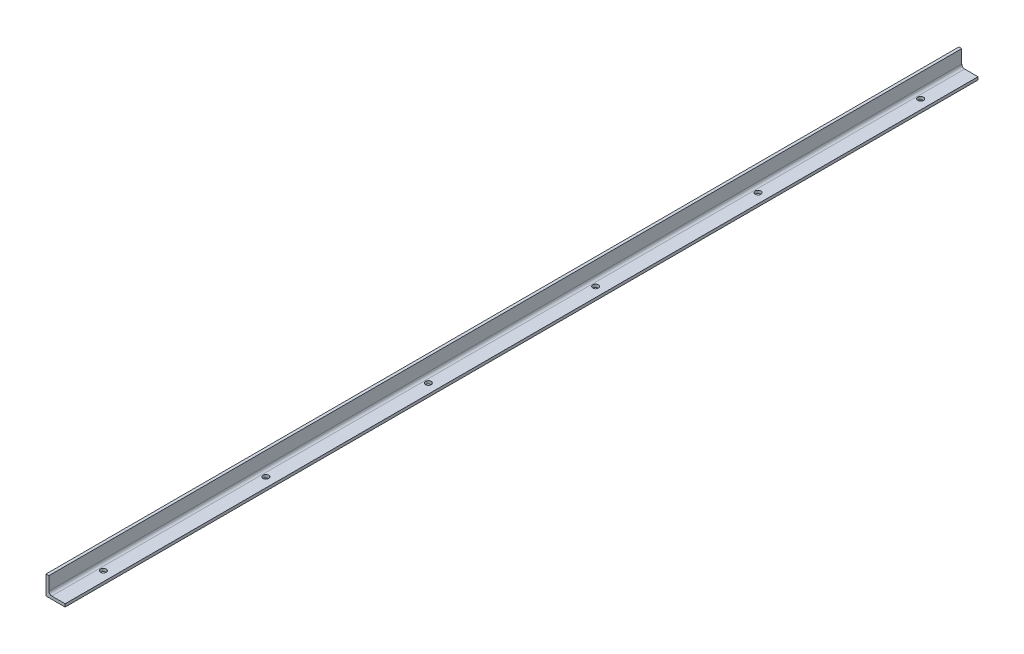
from build123d import *

# Parameters (mm, degrees)
BOSS_EXTRU_1_DEPTH      = 955
ESQUISSE2_R             = 3
ENL_V_MAT_EXTRU_1_DEPTH = 955


with BuildPart() as part:
    # Esquisse1 → Boss.-Extru.1 (new body)
    with BuildSketch(Plane.XY):
        with BuildLine():
            Line((0, 0), (0, 20))
            Line((0, 20), (3, 20))
            Line((3, 20), (3, 6))
            ThreePointArc((3, 6), (3.878679656, 3.878679656), (6, 3))
            Line((6, 3), (20, 3))
            Line((20, 3), (20, 0))
            Line((20, 0), (0, 0))
        make_face()
    extrude(amount=BOSS_EXTRU_1_DEPTH)

    # Esquisse2 → Enlèv. mat.-Extru.1 (cut)
    with BuildSketch(Plane(origin=(0, 0, 0), x_dir=(-1, 0, 0), z_dir=(0, -1, 0))):
        with Locations(Location((-10, -50, 0), (0, 0, 180))):
            Circle(ESQUISSE2_R)
        with Locations(Location((-10, -905, 0), (0, 0, 180))):
            Circle(ESQUISSE2_R)
        with Locations(Location((-10, -220, 0), (0, 0, 180))):
            Circle(ESQUISSE2_R)
        with Locations(Location((-10, -735, 0), (0, 0, 180))):
            Circle(ESQUISSE2_R)
        with Locations(Location((-10, -390, 0), (0, 0, 180))):
            Circle(ESQUISSE2_R)
        with Locations(Location((-10, -565, 0), (0, 0, 180))):
            Circle(ESQUISSE2_R)
    extrude(amount=-ENL_V_MAT_EXTRU_1_DEPTH, mode=Mode.SUBTRACT)


solid = part.part
